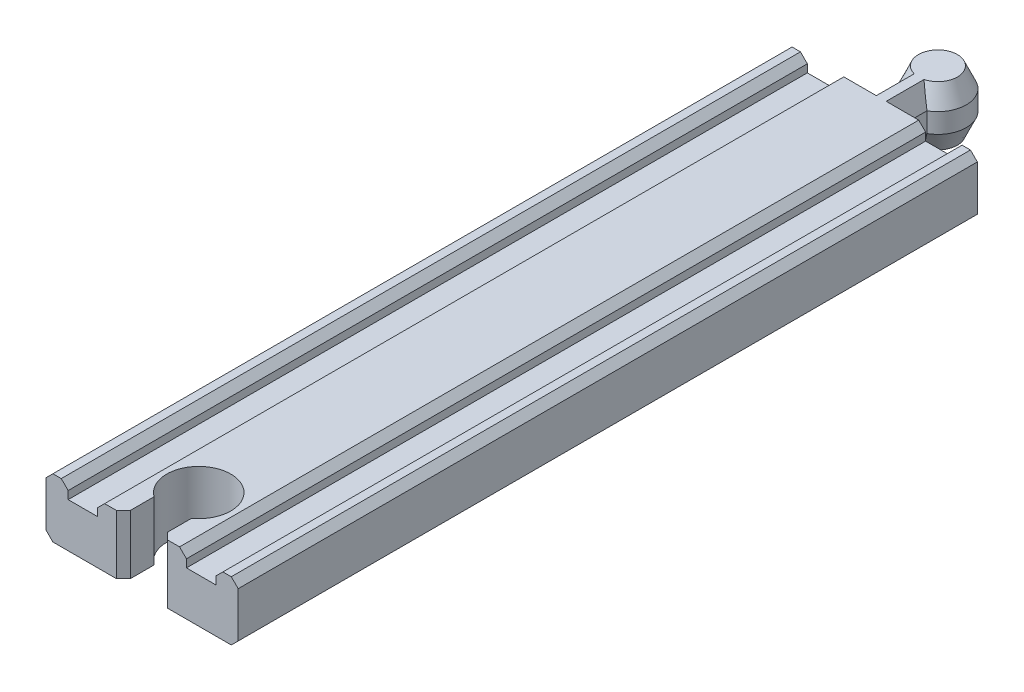
from build123d import *
from OCP.BRepFilletAPI import BRepFilletAPI_MakeChamfer

# Parameters (mm, degrees)
BOSS_EXTRUDE1_DEPTH = 75
CUT_EXTRUDE1_DEPTH  = 79.417153736
CHAMFER1_SIZE       = 1.4
BOSS_EXTRUDE2_DEPTH = 12
CHAMFER2_SIZE       = 4
CHAMFER2_SIZE2      = 1.8


with BuildPart() as part:
    # Sketch2 → Boss-Extrude1 (new, symmetric)
    with BuildSketch(Plane.XY):
        Polygon((-19.5, 0), (19.5, 0), (19.5, 12), (15, 12), (15, 9), (9, 9), (9, 12), (-9, 12), (-9, 9), (-15, 9), (-15, 12), (-19.5, 12), align=None)
    extrude(amount=BOSS_EXTRUDE1_DEPTH, both=True)

    # Sketch3 → Cut-Extrude1 (cut, through all)
    with BuildSketch(Plane(origin=(0, 12, 0), x_dir=(1, 0, 0), z_dir=(0, 1, 0))):
        with BuildLine():
            ThreePointArc((-3.8, -68.773518749), (0, -70), (3.8, -68.773518749))
            Line((3.8, -68.773518749), (3.8, -63.5))
            Line((3.8, -63.5), (-3.8, -63.5))
            Line((-3.8, -63.5), (-3.8, -68.773518749))
        make_face()
        with BuildLine():
            Line((3.8, -63.5), (3.8, -68.773518749))
            ThreePointArc((3.8, -68.773518749), (5.785758377, -66.462262649), (6.5, -63.5))
            ThreePointArc((6.5, -63.5), (-2.962262649, -57.714241623), (-3.8, -68.773518749))
            Line((-3.8, -68.773518749), (-3.8, -63.5))
            Line((-3.8, -63.5), (3.8, -63.5))
        make_face()
        with BuildLine():
            Line((-3.8, -75), (3.8, -75))
            Line((3.8, -75), (3.8, -68.773518749))
            ThreePointArc((3.8, -68.773518749), (0, -70), (-3.8, -68.773518749))
            Line((-3.8, -68.773518749), (-3.8, -75))
        make_face()
    extrude(amount=-CUT_EXTRUDE1_DEPTH, mode=Mode.SUBTRACT)

    # Chamfer1
    chamfer1_edges = [part.edges().sort_by_distance(p)[0] for p in [
        (-19.5, 12, 0),
        (-15, 12, 0),
        (-9, 12, 0),
        (9, 12, 0),
        (15, 12, 0),
        (19.5, 12, 0),
        (19.5, 0, 0),
        (-19.5, 0, 0),
        (3.8, 6, 75),
        (-3.8, 6, 75),
    ]]
    chamfer(chamfer1_edges, length=CHAMFER1_SIZE)

    # Sketch4 → Boss-Extrude2 (add)
    with BuildSketch(Plane(origin=(0, 12, 0), x_dir=(1, 0, 0), z_dir=(0, 1, 0))):
        with BuildLine():
            Line((-2.8, 81.477799287), (-2.8, 86.5))
            Line((-2.8, 86.5), (2.8, 86.5))
            Line((2.8, 86.5), (2.8, 81.477799287))
            ThreePointArc((2.8, 81.477799287), (4.957948164, 83.587741426), (5.75, 86.5))
            ThreePointArc((5.75, 86.5), (-2.912258574, 91.457948164), (-2.8, 81.477799287))
        make_face()
        with BuildLine():
            Line((2.8, 86.5), (-2.8, 86.5))
            Line((-2.8, 86.5), (-2.8, 81.477799287))
            ThreePointArc((-2.8, 81.477799287), (0, 80.75), (2.8, 81.477799287))
            Line((2.8, 81.477799287), (2.8, 86.5))
        make_face()
        with BuildLine():
            ThreePointArc((2.8, 81.477799287), (0, 80.75), (-2.8, 81.477799287))
            Line((-2.8, 81.477799287), (-2.8, 75))
            Line((-2.8, 75), (2.8, 75))
            Line((2.8, 75), (2.8, 81.477799287))
        make_face()
    extrude(amount=-BOSS_EXTRUDE2_DEPTH)

    # Chamfer2: one chamfer whose edges measure the first distance from different faces: ONE call of the kernel's chamfer builder (chamfer() names one face for all edges)
    chamfer2_edges_1 = [part.edges().sort_by_distance(p)[0] for p in [
        (2.8, 0, -78.238899644),
        (2.8, 12, -78.238899644),
    ]]
    chamfer2_side_1 = [part.faces().sort_by_distance(p)[0] for p in [
        (2.8, 6, -78.238899644),
    ]]
    chamfer2_edges_2 = [part.edges().sort_by_distance(p)[0] for p in [
        (0, 12, -92.25),
        (0, 0, -92.25),
    ]]
    chamfer2_side_2 = [part.faces().sort_by_distance(p)[0] for p in [
        (0, 6, -92.25),
    ]]
    chamfer2_edges_3 = [part.edges().sort_by_distance(p)[0] for p in [
        (-2.8, 12, -78.238899644),
        (-2.8, 0, -78.238899644),
    ]]
    chamfer2_side_3 = [part.faces().sort_by_distance(p)[0] for p in [
        (-2.8, 6, -78.238899644),
    ]]
    chamfer2 = BRepFilletAPI_MakeChamfer(part.part.solid().wrapped)
    for e in chamfer2_edges_1:
        chamfer2.Add(CHAMFER2_SIZE, CHAMFER2_SIZE2, e.wrapped, chamfer2_side_1[0].wrapped)  # the first distance lies on this face
    for e in chamfer2_edges_2:
        chamfer2.Add(CHAMFER2_SIZE, CHAMFER2_SIZE2, e.wrapped, chamfer2_side_2[0].wrapped)  # the first distance lies on this face
    for e in chamfer2_edges_3:
        chamfer2.Add(CHAMFER2_SIZE, CHAMFER2_SIZE2, e.wrapped, chamfer2_side_3[0].wrapped)  # the first distance lies on this face
    add(Compound.cast(chamfer2.Shape()), mode=Mode.REPLACE)


solid = part.part
